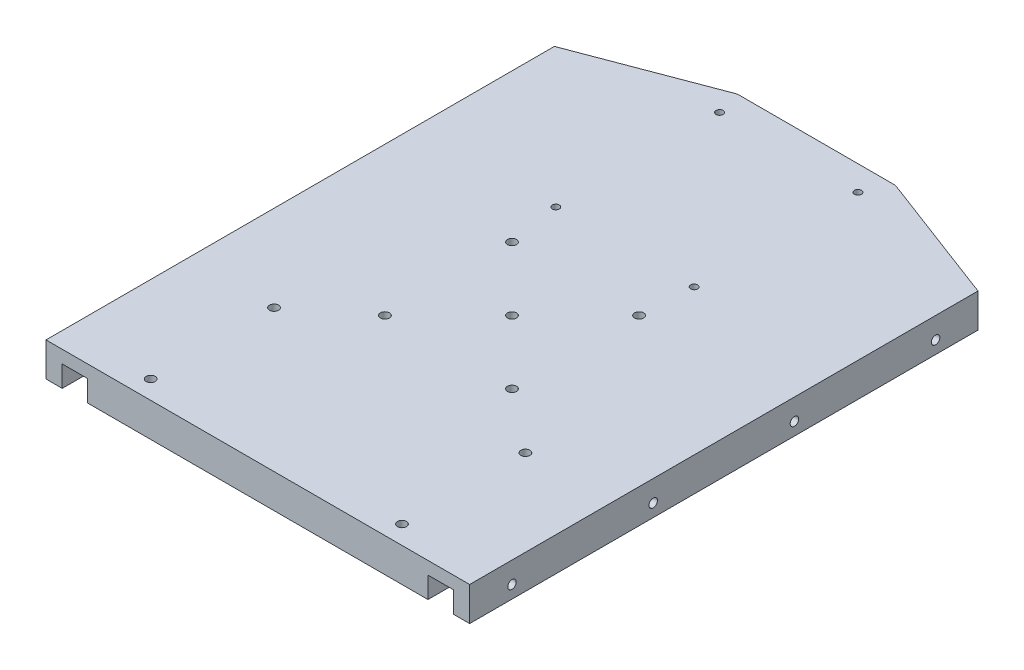
from build123d import *

# Parameters (mm, degrees)
SKETCH1_W                      = 150
SKETCH1_H                      = 180
BOSS_EXTRUDE1_DEPTH            = 12
F_3_0MM_DOWEL_HOLE1_AT_2_COUNT = 2
F_3_0MM_DOWEL_HOLE1_AT_2_PITCH = 50
F_3_0MM_DOWEL_HOLE1_AT_3_COUNT = 2
F_3_0MM_DOWEL_HOLE1_AT_3_PITCH = 100
F_3_0MM_DOWEL_HOLE1_AT_4_COUNT = 2
F_3_0MM_DOWEL_HOLE1_AT_4_PITCH = 50
BOSS_EXTRUDE2_DEPTH            = 12
FILLET4_R                      = 3
CUT_EXTRUDE1_START             = -12
SKETCH14_W                     = 60
SKETCH14_H                     = 85
CUT_EXTRUDE1_DEPTH             = 7
SKETCH17_R                     = 1.25
CUT_EXTRUDE2_DEPTH             = 132.493453829
SKETCH18_W                     = 9
SKETCH18_H                     = 185.579893617
CUT_EXTRUDE3_DEPTH             = 7.5
M3_CLEARANCE_HOLE1_D           = 3.2
M3_CLEARANCE_HOLE2_D           = 3.2


with BuildPart() as part:
    # Sketch1 → Boss-Extrude1 (new body)
    with BuildSketch(Plane(origin=(0, 0, 0), x_dir=(1, 0, 0), z_dir=(0, 1, 0))):
        Rectangle(SKETCH1_W, SKETCH1_H)
    extrude(amount=BOSS_EXTRUDE1_DEPTH)

    # Sketch6 → Ø3.0mm Dowel Hole1 (revolve, cut)
    with BuildSketch(Plane(origin=(75, 4.5, 25), x_dir=(0, 0, -1), z_dir=(0, 1, 0))):
        Polygon((0, 0), (0, 5.901290929), (1.5, 5), (1.5, 0), align=None)
    f_3_0mm_dowel_hole1 = revolve(axis=Axis((81.35, 4.5, 25), (-1, 0, 0)), mode=Mode.SUBTRACT)

    # Ø3.0mm Dowel Hole1 at 2: Ø3.0mm Dowel Hole1 ×2
    with Locations(*[(0, 0, i * F_3_0MM_DOWEL_HOLE1_AT_2_PITCH) for i in range(1, F_3_0MM_DOWEL_HOLE1_AT_2_COUNT)]):
        add(f_3_0mm_dowel_hole1, mode=Mode.SUBTRACT)

    # Ø3.0mm Dowel Hole1 at 3: Ø3.0mm Dowel Hole1 ×2
    with Locations(*[(0, 0, -i * F_3_0MM_DOWEL_HOLE1_AT_3_PITCH) for i in range(1, F_3_0MM_DOWEL_HOLE1_AT_3_COUNT)]):
        add(f_3_0mm_dowel_hole1, mode=Mode.SUBTRACT)

    # Ø3.0mm Dowel Hole1 at 4: Ø3.0mm Dowel Hole1 ×2
    with Locations(*[(0, 0, -i * F_3_0MM_DOWEL_HOLE1_AT_4_PITCH) for i in range(1, F_3_0MM_DOWEL_HOLE1_AT_4_COUNT)]):
        add(f_3_0mm_dowel_hole1, mode=Mode.SUBTRACT)

    # Mirror1: Ø3.0mm Dowel Hole1 across plane
    add(f_3_0mm_dowel_hole1.mirror(Plane(origin=(0, 0, 0), x_dir=(0, 0, 1), z_dir=(1, 0, 0))), mode=Mode.SUBTRACT)

    # Mirror1 copy 1 sketch → Mirror1 copy 1 (revolve, cut)
    with BuildSketch(Plane(origin=(-75, 4.5, 75), x_dir=(0, 0, -1), z_dir=(0, 1, 0))):
        Polygon((0, 0), (0, -5.901290929), (1.5, -5), (1.5, 0), align=None)
    revolve(axis=Axis((-81.35, 4.5, 75), (-1, 0, 0)), mode=Mode.SUBTRACT)

    # Mirror1 copy 2 sketch → Mirror1 copy 2 (revolve, cut)
    with BuildSketch(Plane(origin=(-75, 4.5, -75), x_dir=(0, 0, -1), z_dir=(0, 1, 0))):
        Polygon((0, 0), (0, -5.901290929), (1.5, -5), (1.5, 0), align=None)
    revolve(axis=Axis((-81.35, 4.5, -75), (-1, 0, 0)), mode=Mode.SUBTRACT)

    # Mirror1 copy 3 sketch → Mirror1 copy 3 (revolve, cut)
    with BuildSketch(Plane(origin=(-75, 4.5, -25), x_dir=(0, 0, -1), z_dir=(0, 1, 0))):
        Polygon((0, 0), (0, -5.901290929), (1.5, -5), (1.5, 0), align=None)
    revolve(axis=Axis((-81.35, 4.5, -25), (-1, 0, 0)), mode=Mode.SUBTRACT)

    # Sketch13 → Boss-Extrude2 (add)
    with BuildSketch(Plane(origin=(0, 12, 0), x_dir=(1, 0, 0), z_dir=(0, 1, 0))):
        Polygon((-75, 90), (75, 90), (28, 107.78), (-28, 107.78), align=None)
    extrude(amount=-BOSS_EXTRUDE2_DEPTH)

    # Fillet4
    fillet4_edges = [part.edges().sort_by_distance(p)[0] for p in [
        (28, 6, -107.78),
        (-28, 6, -107.78),
    ]]
    fillet(fillet4_edges, radius=FILLET4_R)

    # Sketch14 → Cut-Extrude1 (cut)
    with BuildSketch(Plane(origin=(0, 12, 0), x_dir=(1, 0, 0), z_dir=(0, 1, 0)).offset(CUT_EXTRUDE1_START)):
        with Locations((0, 65.28)):
            Rectangle(SKETCH14_W, SKETCH14_H)
    extrude(amount=CUT_EXTRUDE1_DEPTH, mode=Mode.SUBTRACT)

    # Sketch17 → Cut-Extrude2 (cut, through all)
    with BuildSketch(Plane(origin=(0, 7, 0), x_dir=(-1, 0, 0), z_dir=(0, -1, 0))):
        with Locations(Location((25.5, 99, 0), (0, 0, 90))):
            Circle(SKETCH17_R)
        with Locations(Location((-23.5, 99, 0), (0, 0, 90))):
            Circle(SKETCH17_R)
        with Locations(Location((25.5, 41, 0), (0, 0, 90))):
            Circle(SKETCH17_R)
        with Locations(Location((-23.5, 41, 0), (0, 0, 90))):
            Circle(SKETCH17_R)
    extrude(amount=-CUT_EXTRUDE2_DEPTH, mode=Mode.SUBTRACT)

    # Sketch18 → Cut-Extrude3 (cut)
    with BuildSketch(Plane.XZ):
        with Locations((64.75, -2.789946809)):
            Rectangle(SKETCH18_W, SKETCH18_H)
        with Locations((-64.75, -2.789946809)):
            Rectangle(SKETCH18_W, SKETCH18_H)
    extrude(amount=-CUT_EXTRUDE3_DEPTH, mode=Mode.SUBTRACT)

    # M3 Clearance Hole1 (through all)
    with Locations(Plane(origin=(0, 12, 0), x_dir=(1, 0, 0), z_dir=(0, 1, 0))):
        with Locations((-44.5, -83.45), (-44.5, -39.75)):
            m3_clearance_hole1 = Hole(M3_CLEARANCE_HOLE1_D / 2)

    # Mirror2: M3 Clearance Hole1 across plane
    add(m3_clearance_hole1.mirror(Plane(origin=(0, 0, 0), x_dir=(0, 0, 1), z_dir=(1, 0, 0))), mode=Mode.SUBTRACT)

    # M3 Clearance Hole2 (through all)
    with Locations(Plane(origin=(0, 12, 0), x_dir=(1, 0, 0), z_dir=(0, 1, 0))):
        with Locations((0, 0), (-22.5, -22.5), (22.5, 22.5), (22.5, -22.5), (-22.5, 22.5)):
            Hole(M3_CLEARANCE_HOLE2_D / 2)


solid = part.part
